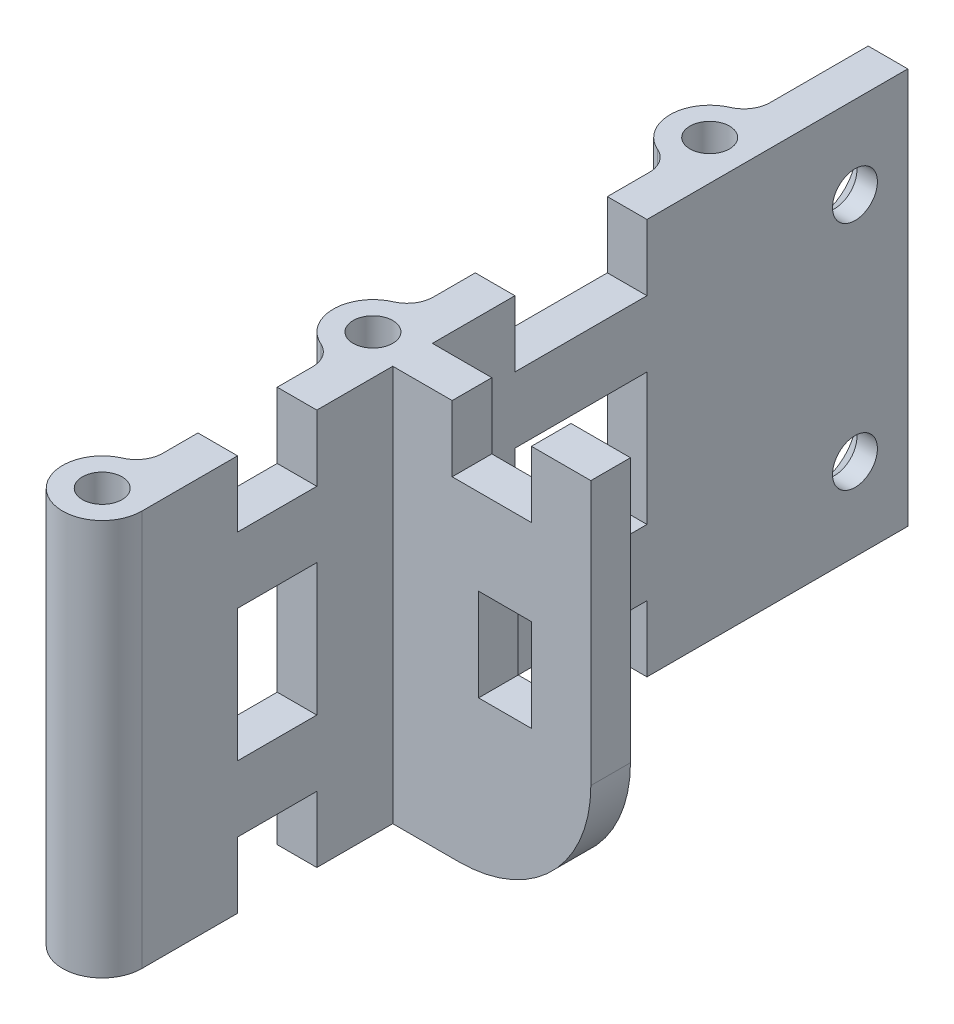
from build123d import *

# Parameters (mm, degrees)
BOSS_EXTRUDE1_DEPTH                                 = 30
CSK_FOR_M3_COUNTERSUNK_FLAT_HEAD_SCREW1_D           = 3.4
CSK_FOR_M3_COUNTERSUNK_FLAT_HEAD_SCREW1_CSINK_D     = 6.3
CSK_FOR_M3_COUNTERSUNK_FLAT_HEAD_SCREW1_CSINK_ANGLE = 90
SKETCH4_R                                           = 3
BOSS_EXTRUDE2_DEPTH                                 = 30
SKETCH5_R                                           = 1.5
CUT_EXTRUDE1_DEPTH                                  = 71.320693967
CUT_EXTRUDE2_REACH                                  = 52.2
SKETCH7_W                                           = 4
SKETCH7_H                                           = 7
CUT_EXTRUDE3_REACH                                  = 72.321
SKETCH10_W                                          = 10
SKETCH10_H                                          = 5
SKETCH10_W_2                                        = 6
SKETCH10_H_2                                        = 10
CUT_EXTRUDE4_REACH                                  = 54.393
SKETCH11_W                                          = 6
SKETCH11_H                                          = 5
FILLET1_R                                           = 2
FILLET2_R                                           = 10


with BuildPart() as part:
    # Sketch1 → Boss-Extrude1 (new body)
    with BuildSketch(Plane(origin=(0, 0, 0), x_dir=(1, 0, 0), z_dir=(0, 1, 0))):
        Polygon((0, -58), (0, 0), (3, 0), (3, -36), (18, -36), (18, -39), (3, -39), (3, -58), align=None)
    extrude(amount=BOSS_EXTRUDE1_DEPTH)

    # CSK for M3 Countersunk Flat Head Screw1 (through all)
    with Locations(Plane.ZY):
        with Locations((4, 23.75), (4, 6.25)):
            CounterSinkHole(CSK_FOR_M3_COUNTERSUNK_FLAT_HEAD_SCREW1_D / 2, CSK_FOR_M3_COUNTERSUNK_FLAT_HEAD_SCREW1_CSINK_D / 2, counter_sink_angle=CSK_FOR_M3_COUNTERSUNK_FLAT_HEAD_SCREW1_CSINK_ANGLE)

    # Sketch4 → Boss-Extrude2 (add)
    with BuildSketch(Plane(origin=(0, 0, 0), x_dir=(1, 0, 0), z_dir=(0, 1, 0))):
        with Locations((0, -12)):
            Circle(SKETCH4_R)
        with Locations((0, -37.5)):
            Circle(SKETCH4_R)
        with Locations((0, -58)):
            Circle(SKETCH4_R)
    extrude(amount=BOSS_EXTRUDE2_DEPTH)

    # Sketch5 → Cut-Extrude1 (cut, through all)
    with BuildSketch(Plane(origin=(0, 30, 0), x_dir=(1, 0, 0), z_dir=(0, 1, 0))):
        with Locations(Location((0, -12, 0), (0, 0, 270))):
            Circle(SKETCH5_R)
        with Locations(Location((0, -37.5, 0), (0, 0, 270))):
            Circle(SKETCH5_R)
        with Locations(Location((0, -58, 0), (0, 0, 270))):
            Circle(SKETCH5_R)
    extrude(amount=-CUT_EXTRUDE1_DEPTH, mode=Mode.SUBTRACT)

    # Sketch7 → Cut-Extrude2 (cut, up to next)
    with BuildSketch(Plane(origin=(0, 0, 36), x_dir=(-1, 0, 0), z_dir=(0, 0, -1)), mode=Mode.PRIVATE) as cut_extrude2_sk1:
        with Locations((-11.5, 15)):
            Rectangle(SKETCH7_W, SKETCH7_H)
    cut_extrude2_tool1 = extrude(cut_extrude2_sk1.sketch, amount=-CUT_EXTRUDE2_REACH, mode=Mode.PRIVATE) & part.part
    add(cut_extrude2_tool1.solids().sort_by_distance((11.5, 15, 36))[0], mode=Mode.SUBTRACT)

    # Sketch10 → Cut-Extrude3 (cut, up to next)
    with BuildSketch(Plane.ZY, mode=Mode.PRIVATE) as cut_extrude3_sk1:
        with Locations((24.75, 27.5)):
            Rectangle(SKETCH10_W, SKETCH10_H)
    cut_extrude3_tool1 = extrude(cut_extrude3_sk1.sketch, amount=-CUT_EXTRUDE3_REACH, mode=Mode.PRIVATE) & part.part
    # Sketch10 → Cut-Extrude3 (cut, up to next)
    with BuildSketch(Plane.ZY, mode=Mode.PRIVATE) as cut_extrude3_sk2:
        with Locations((47.75, 27.5)):
            Rectangle(SKETCH10_W_2, SKETCH10_H)
    cut_extrude3_tool2 = extrude(cut_extrude3_sk2.sketch, amount=-CUT_EXTRUDE3_REACH, mode=Mode.PRIVATE) & part.part
    # Sketch10 → Cut-Extrude3 (cut, up to next)
    with BuildSketch(Plane.ZY, mode=Mode.PRIVATE) as cut_extrude3_sk3:
        with Locations((24.75, 2.5)):
            Rectangle(SKETCH10_W, SKETCH10_H)
    cut_extrude3_tool3 = extrude(cut_extrude3_sk3.sketch, amount=-CUT_EXTRUDE3_REACH, mode=Mode.PRIVATE) & part.part
    # Sketch10 → Cut-Extrude3 (cut, up to next)
    with BuildSketch(Plane.ZY, mode=Mode.PRIVATE) as cut_extrude3_sk4:
        with Locations((47.75, 2.5)):
            Rectangle(SKETCH10_W_2, SKETCH10_H)
    cut_extrude3_tool4 = extrude(cut_extrude3_sk4.sketch, amount=-CUT_EXTRUDE3_REACH, mode=Mode.PRIVATE) & part.part
    # Sketch10 → Cut-Extrude3 (cut, up to next)
    with BuildSketch(Plane.ZY, mode=Mode.PRIVATE) as cut_extrude3_sk5:
        with Locations((24.75, 15)):
            Rectangle(SKETCH10_W, SKETCH10_H_2)
    cut_extrude3_tool5 = extrude(cut_extrude3_sk5.sketch, amount=-CUT_EXTRUDE3_REACH, mode=Mode.PRIVATE) & part.part
    # Sketch10 → Cut-Extrude3 (cut, up to next)
    with BuildSketch(Plane.ZY, mode=Mode.PRIVATE) as cut_extrude3_sk6:
        with Locations((47.75, 15)):
            Rectangle(SKETCH10_W_2, SKETCH10_H_2)
    cut_extrude3_tool6 = extrude(cut_extrude3_sk6.sketch, amount=-CUT_EXTRUDE3_REACH, mode=Mode.PRIVATE) & part.part
    add(cut_extrude3_tool1.solids().sort_by_distance((0, 27.5, 24.75))[0], mode=Mode.SUBTRACT)
    add(cut_extrude3_tool2.solids().sort_by_distance((0, 27.5, 47.75))[0], mode=Mode.SUBTRACT)
    add(cut_extrude3_tool3.solids().sort_by_distance((0, 2.5, 24.75))[0], mode=Mode.SUBTRACT)
    add(cut_extrude3_tool4.solids().sort_by_distance((0, 2.5, 47.75))[0], mode=Mode.SUBTRACT)
    add(cut_extrude3_tool5.solids().sort_by_distance((0, 15, 24.75))[0], mode=Mode.SUBTRACT)
    add(cut_extrude3_tool6.solids().sort_by_distance((0, 15, 47.75))[0], mode=Mode.SUBTRACT)

    # Sketch11 → Cut-Extrude4 (cut, up to next)
    with BuildSketch(Plane.XY.offset(39), mode=Mode.PRIVATE) as cut_extrude4_sk1:
        with Locations((10.5, 27.5)):
            Rectangle(SKETCH11_W, SKETCH11_H)
    cut_extrude4_tool1 = extrude(cut_extrude4_sk1.sketch, amount=-CUT_EXTRUDE4_REACH, mode=Mode.PRIVATE) & part.part
    add(cut_extrude4_tool1.solids().sort_by_distance((10.5, 27.5, 39))[0], mode=Mode.SUBTRACT)

    # Fillet1
    fillet1_edges = [part.edges().sort_by_distance(p)[0] for p in [
        (0, 15, 15),
        (0, 15, 9),
        (0, 15, 40.5),
        (0, 15, 34.5),
        (0, 15, 55),
    ]]
    fillet(fillet1_edges, radius=FILLET1_R)

    # Fillet2
    fillet2_edges = [part.edges().sort_by_distance(p)[0] for p in [
        (18, 0, 37.5),
    ]]
    fillet(fillet2_edges, radius=FILLET2_R)


solid = part.part
